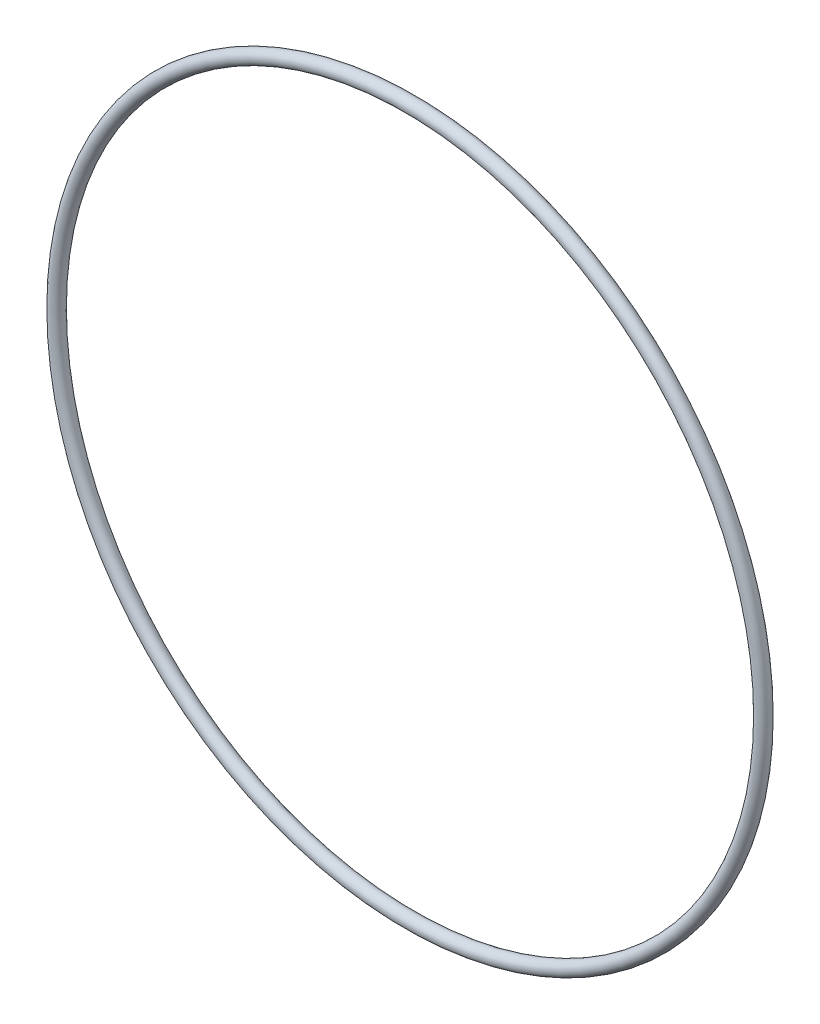
from build123d import *

# Parameters (mm, degrees)
SKETCH1_R = 1.5


with BuildPart() as part:
    # Sketch1 → Revolve1 (revolve)
    with BuildSketch(Plane(origin=(0, 0, 0), x_dir=(0, 0, -1), z_dir=(1, 0, 0))):
        with Locations((0, 76.5)):
            Circle(SKETCH1_R)
    revolve(axis=Axis((0, 0, 0), (0, 0, 1)))


solid = part.part
